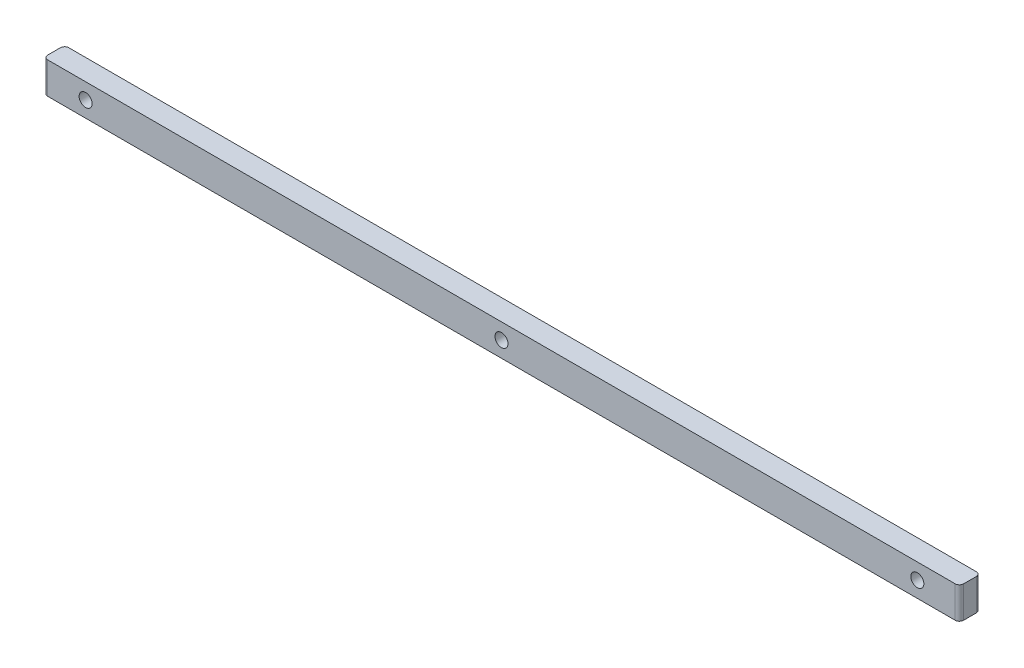
from build123d import *

# Parameters (mm, degrees)
SKETCH1_W               = 552.45
SKETCH1_H               = 19.05
BOSS_EXTRUDE1_DEPTH     = 6.35
CUT_EXTRUDE1_DEPTH      = 277.680802099
CUT_EXTRUDE1_DEPTH_BACK = 277.680802099
SKETCH2_R               = 3.937
FILLET1_R               = 2.54


with BuildPart() as part:
    # Sketch1 → Boss-Extrude1 (new, symmetric)
    with BuildSketch(Plane.XY):
        Rectangle(SKETCH1_W, SKETCH1_H)
    extrude(amount=BOSS_EXTRUDE1_DEPTH, both=True)

    # Sketch2 → Cut-Extrude1 (cut, two sides: drawn at the far end of the back side and taken through both)
    with BuildSketch(Plane.XY.offset(6.35).offset(-CUT_EXTRUDE1_DEPTH_BACK)):
        Circle(SKETCH2_R)
        with Locations((250.825, 0)):
            Circle(SKETCH2_R)
        with Locations((-250.825, 0)):
            Circle(SKETCH2_R)
    extrude(amount=CUT_EXTRUDE1_DEPTH + CUT_EXTRUDE1_DEPTH_BACK, mode=Mode.SUBTRACT)

    # Fillet1
    fillet1_edges = [part.edges().sort_by_distance(p)[0] for p in [
        (-276.225, 0, 6.35),
        (276.225, 0, 6.35),
        (-276.225, 0, -6.35),
        (276.225, 0, -6.35),
    ]]
    fillet(fillet1_edges, radius=FILLET1_R)


solid = part.part
